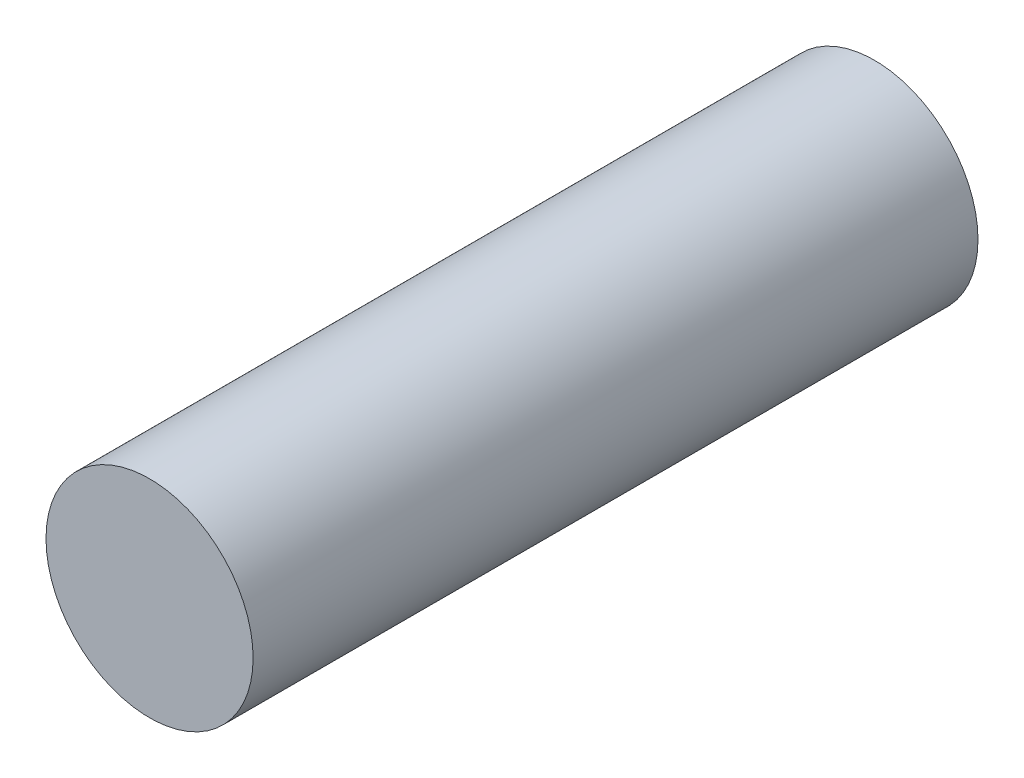
from build123d import *

# Parameters (mm, degrees)
SKETCH1_R           = 5
BOSS_EXTRUDE1_DEPTH = 35


with BuildPart() as part:
    # Sketch1 → Boss-Extrude1 (new body)
    with BuildSketch(Plane.XY):
        Circle(SKETCH1_R)
    extrude(amount=BOSS_EXTRUDE1_DEPTH)


solid = part.part
